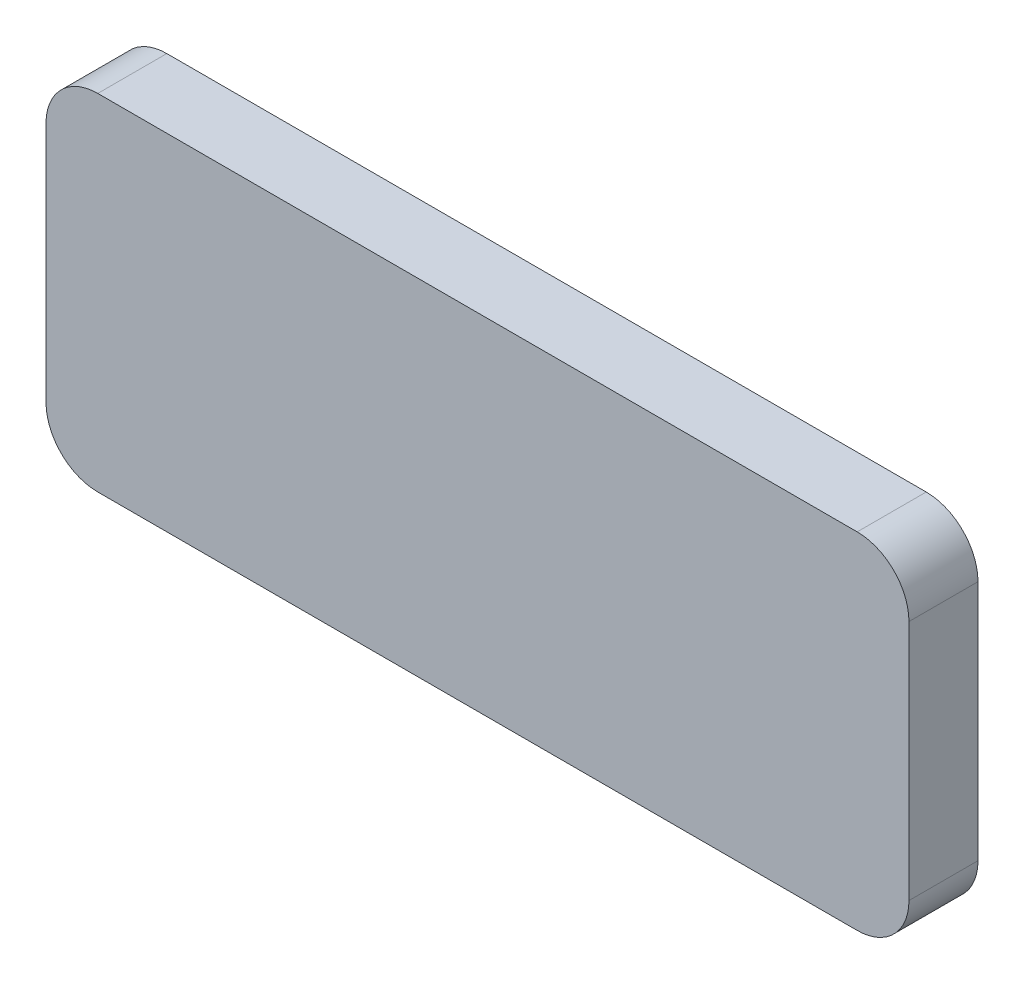
from build123d import *

# Parameters (mm, degrees)
BOSS_EXTRUDE1_DEPTH = 4


with BuildPart() as part:
    # Sketch1 → Boss-Extrude1 (new body)
    with BuildSketch(Plane.XY):
        with BuildLine():
            Line((-22, 58.401174793), (22, 58.401174793))
            ThreePointArc((22, 58.401174793), (24.121320344, 57.522495136), (25, 55.401174793))
            Line((25, 55.401174793), (25, 41.401174793))
            ThreePointArc((25, 41.401174793), (24.121320344, 39.279854449), (22, 38.401174793))
            Line((22, 38.401174793), (-22, 38.401174793))
            ThreePointArc((-22, 38.401174793), (-24.121320344, 39.279854449), (-25, 41.401174793))
            Line((-25, 41.401174793), (-25, 55.401174793))
            ThreePointArc((-25, 55.401174793), (-24.121320344, 57.522495136), (-22, 58.401174793))
        make_face()
    extrude(amount=BOSS_EXTRUDE1_DEPTH)


solid = part.part
